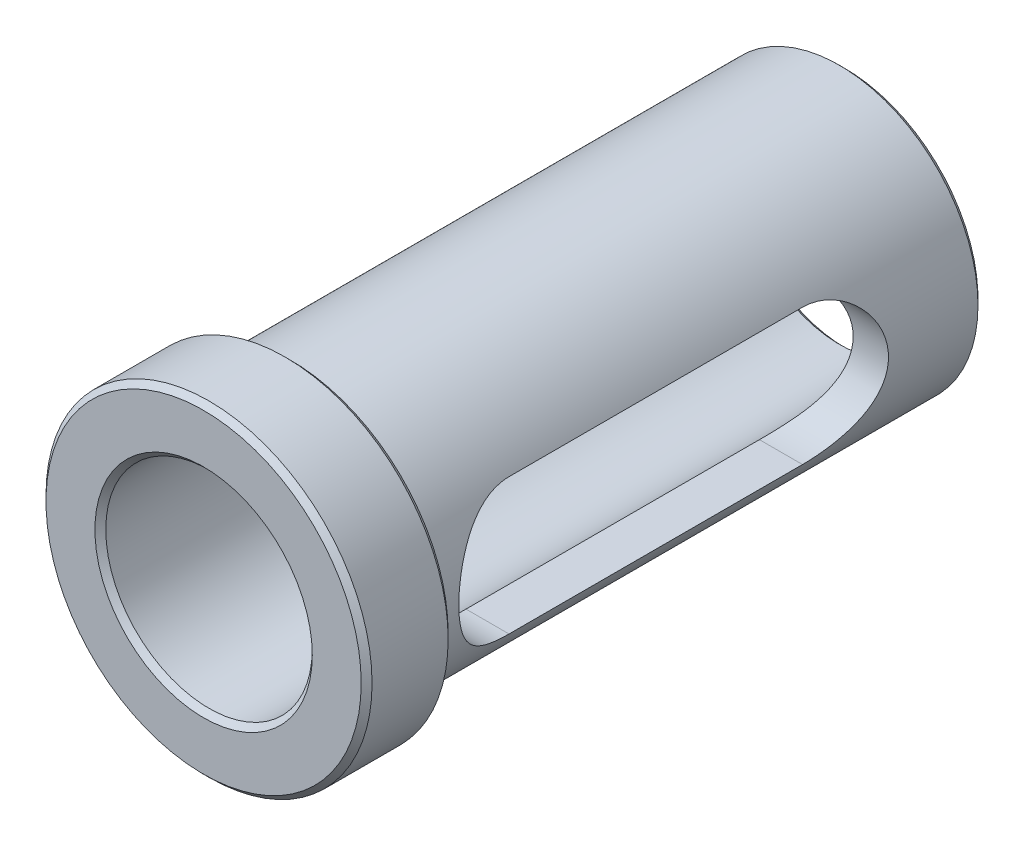
from build123d import *

# Parameters (mm, degrees)
SCHIZZO1_W                   = 118
SCHIZZO1_H                   = 60
ESTRUSIONE_ESTRUSIONE1_DEPTH = 60
TAGLIO_ESTRUSIONE1_DEPTH     = 30
SCHIZZO3_W                   = 60
SCHIZZO3_H                   = 60
SCHIZZO3_R                   = 25.5
TAGLIO_ESTRUSIONE4_DEPTH     = 102
TAGLIO_ESTRUSIONE5_DEPTH     = 18
SCHIZZO5_R                   = 19
TAGLIO_ESTRUSIONE6_DEPTH     = 136.735036008
SMUSSO1_SIZE                 = 1
SMUSSO2_SIZE                 = 1
SMUSSO3_SIZE                 = 1
SMUSSO4_SIZE                 = 1
SMUSSO5_SIZE                 = 1


with BuildPart() as part:
    # Schizzo1 → Estrusione-Estrusione1 (new body)
    with BuildSketch(Plane(origin=(0, 0, 0), x_dir=(0, 0, -1), z_dir=(1, 0, 0))):
        Rectangle(SCHIZZO1_W, SCHIZZO1_H)
    extrude(amount=-ESTRUSIONE_ESTRUSIONE1_DEPTH)

    # Schizzo2 → Taglio-Estrusione1 (cut)
    with BuildSketch(Plane(origin=(0, 0, 0), x_dir=(0, 0, -1), z_dir=(1, 0, 0))):
        with BuildLine():
            Line((29, 12.534031414), (-25, 12.534031414))
            ThreePointArc((-25, 12.534031414), (-37.534031414, 0), (-25, -12.534031414))
            Line((-25, -12.534031414), (29, -12.534031414))
            ThreePointArc((29, -12.534031414), (41.534031414, 0), (29, 12.534031414))
        make_face()
    extrude(amount=-TAGLIO_ESTRUSIONE1_DEPTH, mode=Mode.SUBTRACT)

    # Schizzo3 → Taglio-Estrusione4 (cut)
    with BuildSketch(Plane(origin=(0, 0, -59), x_dir=(-1, 0, 0), z_dir=(0, 0, -1))):
        with Locations((30, 0)):
            Rectangle(SCHIZZO3_W, SCHIZZO3_H)
        with Locations((30, 0)):
            Circle(SCHIZZO3_R, mode=Mode.SUBTRACT)
    extrude(amount=-TAGLIO_ESTRUSIONE4_DEPTH, mode=Mode.SUBTRACT)

    # Schizzo4 → Taglio-Estrusione5 (cut)
    with BuildSketch(Plane.XY.offset(59)):
        with BuildLine():
            Line((-30, 30), (-60, 30))
            Line((-60, 30), (-60, 0))
            ThreePointArc((-60, 0), (-51.213203436, 21.213203436), (-30, 30))
        make_face()
        with BuildLine():
            Line((0, 30), (-30, 30))
            ThreePointArc((-30, 30), (-8.786796564, 21.213203436), (0, 0))
            Line((0, 0), (0, 30))
        make_face()
        with BuildLine():
            Line((0, -30), (0, 0))
            ThreePointArc((0, 0), (-8.786796564, -21.213203436), (-30, -30))
            Line((-30, -30), (0, -30))
        make_face()
        with BuildLine():
            ThreePointArc((-30, -30), (-51.213203436, -21.213203436), (-60, 0))
            Line((-60, 0), (-60, -30))
            Line((-60, -30), (-30, -30))
        make_face()
    extrude(amount=-TAGLIO_ESTRUSIONE5_DEPTH, mode=Mode.SUBTRACT)

    # Schizzo5 → Taglio-Estrusione6 (cut, through all)
    with BuildSketch(Plane(origin=(0, 0, -59), x_dir=(-1, 0, 0), z_dir=(0, 0, -1))):
        with Locations((30, 0)):
            Circle(SCHIZZO5_R)
    extrude(amount=-TAGLIO_ESTRUSIONE6_DEPTH, mode=Mode.SUBTRACT)

    # Smusso1
    smusso1_edges = [part.edges().sort_by_distance(p)[0] for p in [
        (-11, 0, -59),
    ]]
    chamfer(smusso1_edges, length=SMUSSO1_SIZE)

    # Smusso2
    smusso2_edges = [part.edges().sort_by_distance(p)[0] for p in [
        (-4.5, 0, -59),
    ]]
    chamfer(smusso2_edges, length=SMUSSO2_SIZE)

    # Smusso3
    smusso3_edges = [part.edges().sort_by_distance(p)[0] for p in [
        (-60, 0, 43),
    ]]
    chamfer(smusso3_edges, length=SMUSSO3_SIZE)

    # Smusso4
    smusso4_edges = [part.edges().sort_by_distance(p)[0] for p in [
        (-11, 0, 59),
    ]]
    chamfer(smusso4_edges, length=SMUSSO4_SIZE)

    # Smusso5
    smusso5_edges = [part.edges().sort_by_distance(p)[0] for p in [
        (-60, 0, 59),
    ]]
    chamfer(smusso5_edges, length=SMUSSO5_SIZE)


solid = part.part
